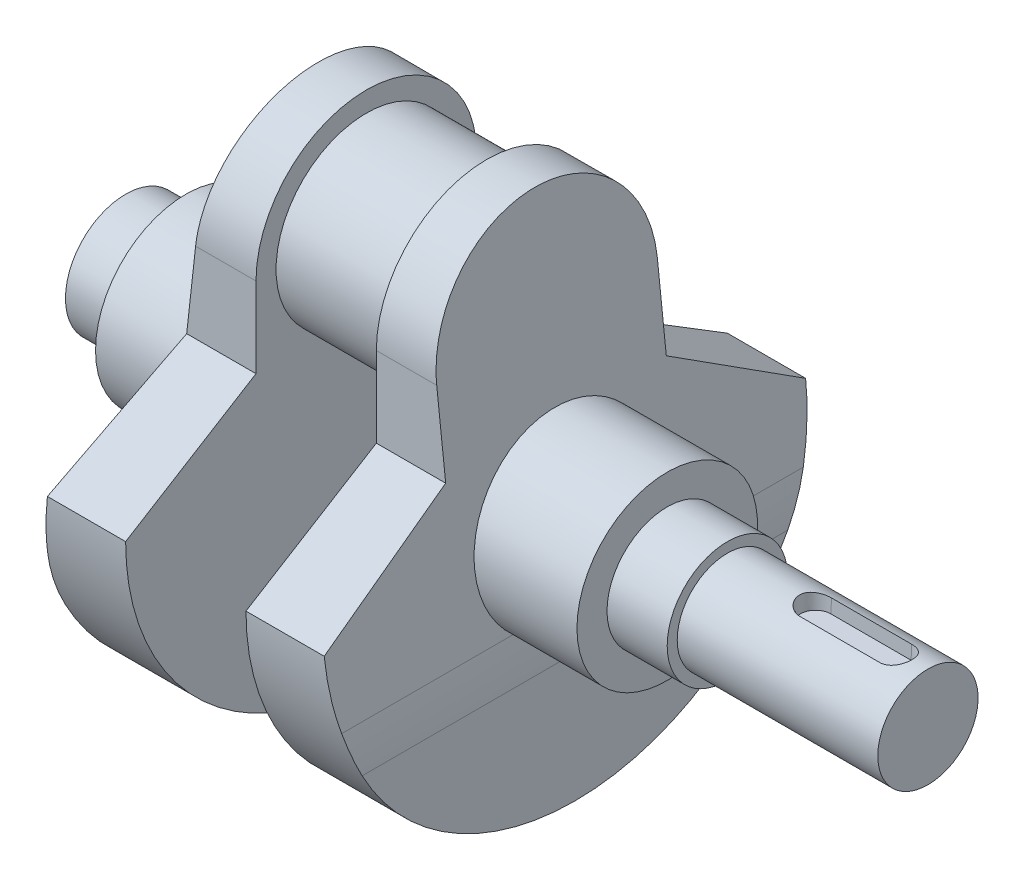
from build123d import *

# Parameters (mm, degrees)
SKETCH2_R               = 22.5
BOSS_EXTRUDE1_DEPTH     = 15
BOSS_EXTRUDE2_DEPTH     = 22
CUT_EXTRUDE2_DEPTH      = 119.676029593
CUT_EXTRUDE2_DEPTH_BACK = 119.676029593
FILLET1_R               = 100
CUT_EXTRUDE3_START      = -27.5
CUT_EXTRUDE3_DEPTH      = 4
CUT_EXTRUDE3_DRAFT      = -3
CUT_EXTRUDE7_DEPTH      = 183.208671748
CUT_EXTRUDE7_DEPTH_BACK = 183.208671748


with BuildPart() as part:
    # Sketch2 → Boss-Extrude1 (new body)
    with BuildSketch(Plane(origin=(0, 0, 0), x_dir=(0, 0, -1), z_dir=(1, 0, 0))):
        Circle(SKETCH2_R)
    extrude(amount=BOSS_EXTRUDE1_DEPTH)

    # Sketch3 → Boss-Extrude2 (add)
    with BuildSketch(Plane(origin=(0, 0, 0), x_dir=(0, 0, -1), z_dir=(1, 0, 0))):
        with BuildLine():
            Line((-27.5, 0), (-27.5, -20))
            Line((-27.5, -20), (-60, -40))
            ThreePointArc((-60, -40), (0, -100), (60, -40))
            Line((60, -40), (27.5, -20))
            Line((27.5, -20), (27.5, 0))
            ThreePointArc((27.5, 0), (0, 27.5), (-27.5, 0))
        make_face()
    extrude(amount=-BOSS_EXTRUDE2_DEPTH)

    # Sketch4 → Cut-Extrude2 (cut, two sides: drawn at the far end of the back side and taken through both)
    with BuildSketch(Plane.XY.offset(-CUT_EXTRUDE2_DEPTH_BACK)):
        Polygon((-12, 27.5), (-22, 27.5), (-22, -62.5), align=None)
    extrude(amount=CUT_EXTRUDE2_DEPTH + CUT_EXTRUDE2_DEPTH_BACK, mode=Mode.SUBTRACT)

    # Fillet1
    fillet1_edges = [part.edges().sort_by_distance(p)[0] for p in [
        (-22, -62.5, 0),
    ]]
    fillet(fillet1_edges, radius=FILLET1_R)

    # Sketch6 → Revolve1 (revolve)
    with BuildSketch(Plane.XY, mode=Mode.PRIVATE) as revolve1_sk:
        Polygon((-17, -17.5), (-45, -17.5), (-45, -25), (-60, -25), (-60, -27.5), (-110, -27.5), (-110, -40), (-17, -40), align=None)
    revolve(revolve1_sk.sketch.rotate(Axis((0, -40, 0), (1, 0, 0)), 90), axis=Axis((0, -40, 0), (1, 0, 0)))


with BuildPart() as cut_extrude3_tool:
    # Sketch8 → Cut-Extrude3 (with draft: the straight prism first)
    with BuildSketch(Plane(origin=(0, 0, 0), x_dir=(1, 0, 0), z_dir=(0, 1, 0)).offset(CUT_EXTRUDE3_START)):
        with BuildLine():
            ThreePointArc((-82, -4), (-78, 0), (-82, 4))
            Line((-82, 4), (-102, 4))
            ThreePointArc((-102, 4), (-106, 0), (-102, -4))
            Line((-102, -4), (-82, -4))
        make_face()
    extrude(amount=-CUT_EXTRUDE3_DEPTH)
    # Cut-Extrude3: the draft: its side faces are tilted about the plane it starts from
    cut_extrude3_sides = [cut_extrude3_tool.faces().sort_by_distance(p)[0] for p in [
        (-78, -29.5, 0),
        (-92, -29.5, -4),
        (-106, -29.5, 0),
        (-92, -29.5, 4),
    ]]
    draft(cut_extrude3_sides, Plane(origin=(0, 0, 0), x_dir=(1, 0, 0), z_dir=(0, 1, 0)).offset(CUT_EXTRUDE3_START), CUT_EXTRUDE3_DRAFT)


with BuildPart() as part_1:
    add(part.part)

    # Cut-Extrude3: cut by cut_extrude3_tool
    add(cut_extrude3_tool.part, mode=Mode.SUBTRACT)

    # Mirror2: part across plane


with BuildPart() as part_2:
    add(part_1.part)
    add(part_1.part.mirror(Plane(origin=(15, 0, 0), x_dir=(0, 0, 1), z_dir=(1, 0, 0))))

    # Sketch9 → Cut-Extrude7 (cut, two sides: drawn at the far end of the back side and taken through both)
    with BuildSketch(Plane.XY.offset(-CUT_EXTRUDE7_DEPTH_BACK)):
        Polygon((-60, -63.744180842), (-60, 19.972023277), (-60, 24.234333035), (-120.234198747, 24.234333035), (-120.234198747, -63.744180842), align=None)
    extrude(amount=CUT_EXTRUDE7_DEPTH + CUT_EXTRUDE7_DEPTH_BACK, mode=Mode.SUBTRACT)


solid = part_2.part
